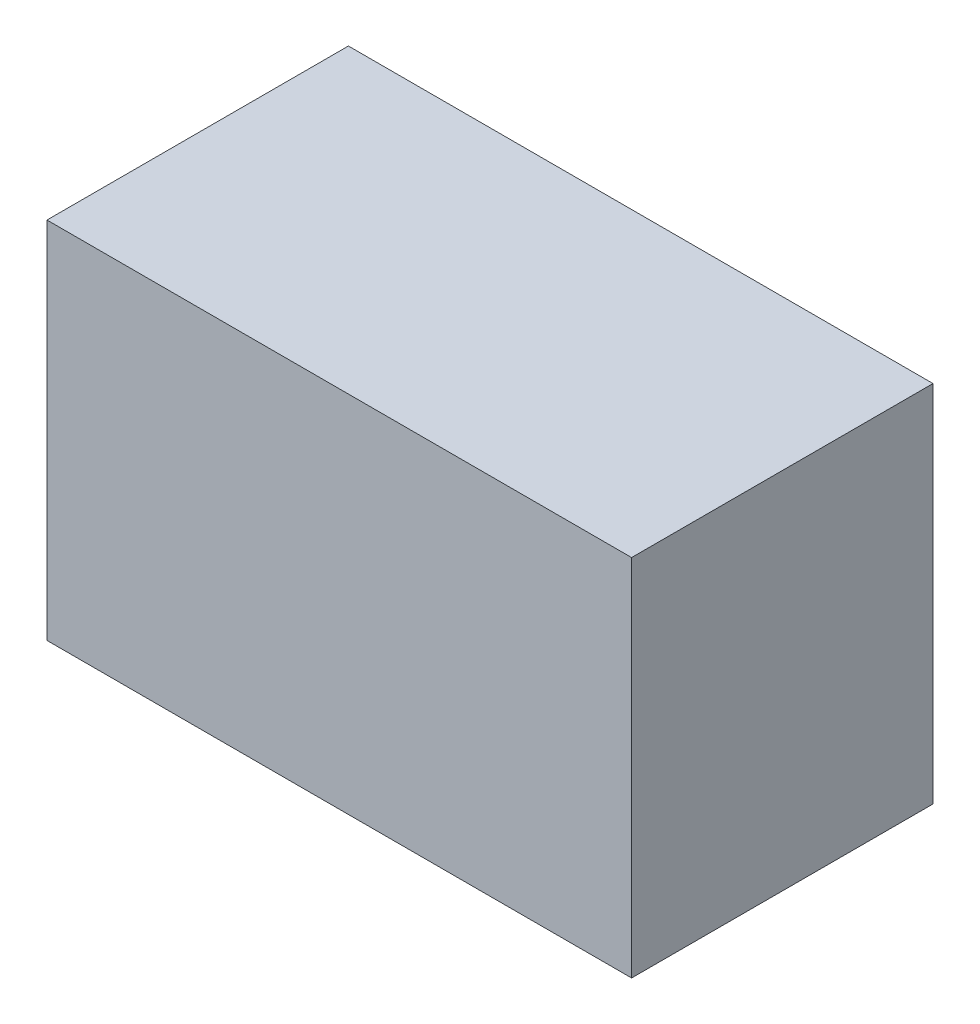
from build123d import *

# Parameters (mm, degrees)
SKETCH1_W           = 289
SKETCH1_H           = 180
BOSS_EXTRUDE1_DEPTH = 149


with BuildPart() as part:
    # Sketch1 → Boss-Extrude1 (new body)
    with BuildSketch(Plane.XY):
        Rectangle(SKETCH1_W, SKETCH1_H)
    extrude(amount=BOSS_EXTRUDE1_DEPTH)


solid = part.part
